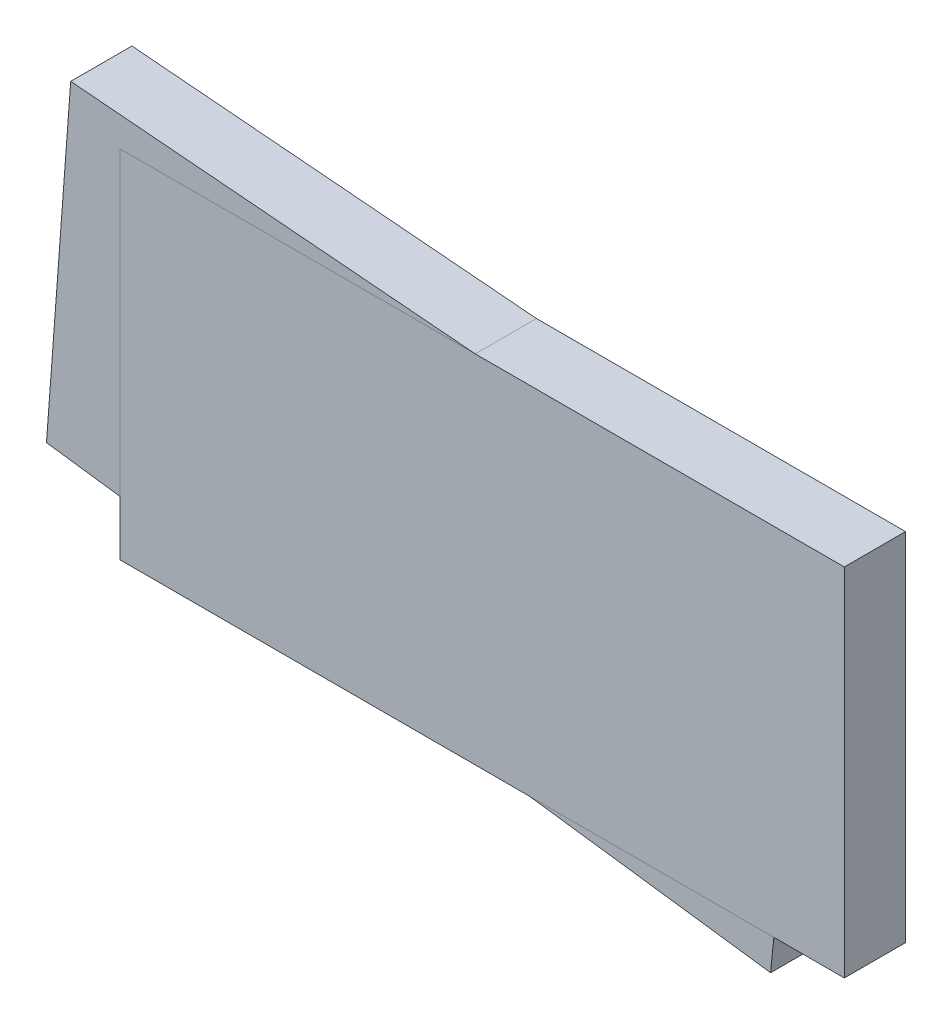
from build123d import *

# Parameters (mm, degrees)
SKIZZE1_W                       = 177.46438251
SKIZZE1_H                       = 87.215049504
AUFSATZ_LINEAR_AUSTRAGEN1_DEPTH = 15
AUFSATZ_LINEAR_AUSTRAGEN2_DEPTH = 15


with BuildPart() as part:
    # Skizze1 → Aufsatz-Linear austragen1 (new body)
    with BuildSketch(Plane.XY):
        Rectangle(SKIZZE1_W, SKIZZE1_H)
    extrude(amount=AUFSATZ_LINEAR_AUSTRAGEN1_DEPTH)


with BuildPart() as body_2:
    # Skizze2 → Aufsatz-Linear austragen2 (new body)
    with BuildSketch(Plane.XY):
        Polygon((70.668259519, -51.523908356), (79.61386178, 36.827206877), (-100.800517253, 51.873409078), (-106.73768376, -27.747764706), align=None)
    extrude(amount=AUFSATZ_LINEAR_AUSTRAGEN2_DEPTH)


solid = Compound([part.part, body_2.part])
